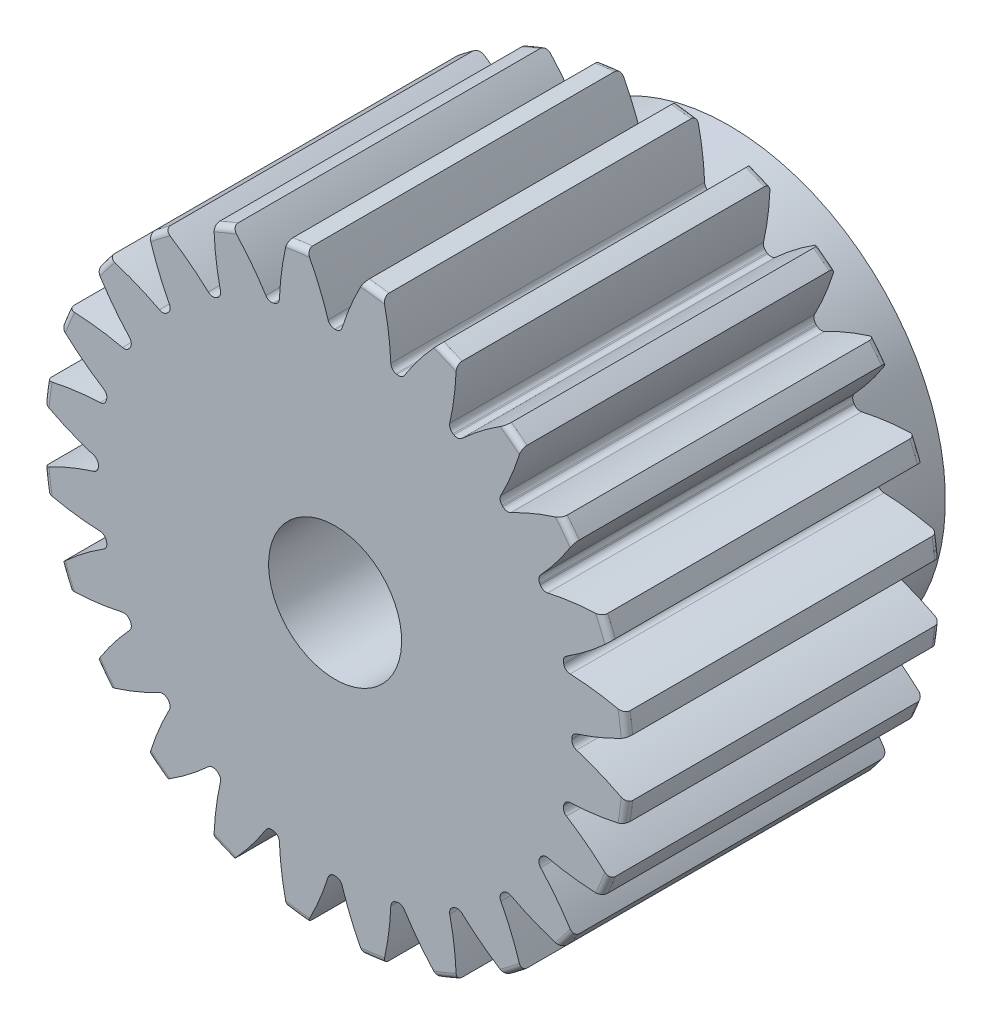
from build123d import *

# Parameters (mm, degrees)
FILLET2_R           = 0.2751582
CUT_EXTRUDE2_DEPTH  = 25.404753734
CIRPATTERN1_COUNT   = 24
SKETCH8_R           = 10.16
BOSS_EXTRUDE1_DEPTH = 2.54
SKETCH14_R          = 10.16
BOSS_EXTRUDE2_DEPTH = 1.2192
SKETCH15_R          = 3.1242
CUT_EXTRUDE3_DEPTH  = 36.068


with BuildPart() as part:
    # Sketch4 → Revolve1 (revolve)
    with BuildSketch(Plane(origin=(0, 0, 0), x_dir=(0, 0, -1), z_dir=(1, 0, 0)), mode=Mode.PRIVATE) as revolve1_sk:
        Polygon((-14.732, 3.175), (-14.732, 0), (0, 0), (0, 3.175), (0, 13.75791), (-14.732, 13.75791), align=None)
    revolve(revolve1_sk.sketch.rotate(Axis((0, 0, 14.732), (0, 0, -1)), 180), axis=Axis((0, 0, 14.732), (0, 0, -1)))

    # Fillet2
    fillet2_edges = [part.edges().sort_by_distance(p)[0] for p in [
        (0, 13.75791, 0),
        (0, 13.75791, 14.732),
    ]]
    fillet(fillet2_edges, radius=FILLET2_R)

    # Sketch7 → Cut-Extrude2 (cut, through all)
    with BuildSketch(Plane.XY.offset(14.732)):
        with BuildLine():
            ThreePointArc((-0.025888514, 11.11204651), (0, 11.112076667), (0.025888514, 11.11204651))
            ThreePointArc((0.025888514, 11.11204651), (0.214525602, 11.173608764), (0.329782653, 11.335131749))
            ThreePointArc((0.329782653, 11.335131749), (0.772860919, 12.539479189), (1.335214608, 13.692964965))
            ThreePointArc((1.335214608, 13.692964965), (0, 13.75791), (-1.335214608, 13.692964965))
            ThreePointArc((-1.335214608, 13.692964965), (-0.772860919, 12.539479189), (-0.329782653, 11.335131749))
            ThreePointArc((-0.329782653, 11.335131749), (-0.214525602, 11.173608764), (-0.025888514, 11.11204651))
        make_face()
    cut_extrude2 = extrude(amount=-CUT_EXTRUDE2_DEPTH, mode=Mode.SUBTRACT)

    # CirPattern1: Cut-Extrude2 ×24 about axis
    cirpattern1_axis = Axis((0, 0, 0), (0, 0, 1))
    for i in range(1, CIRPATTERN1_COUNT):
        add(cut_extrude2.rotate(cirpattern1_axis, i * 360 / CIRPATTERN1_COUNT), mode=Mode.SUBTRACT)

    # Sketch8 → Boss-Extrude1 (add)
    with BuildSketch(Plane(origin=(0, 0, 0), x_dir=(-1, 0, 0), z_dir=(0, 0, -1))):
        with Locations(Location((0, 0, 0), (0, 0, 270))):
            Circle(SKETCH8_R)
    extrude(amount=BOSS_EXTRUDE1_DEPTH)

    # Sketch14 → Boss-Extrude2 (add)
    with BuildSketch(Plane(origin=(0, 0, -2.54), x_dir=(-1, 0, 0), z_dir=(0, 0, -1))):
        with Locations(Location((0, 0, 0), (0, 0, 270))):
            Circle(SKETCH14_R)
    extrude(amount=BOSS_EXTRUDE2_DEPTH)

    # Sketch15 → Cut-Extrude3 (cut)
    with BuildSketch(Plane(origin=(0, 0, -3.7592), x_dir=(-1, 0, 0), z_dir=(0, 0, -1))):
        with Locations(Location((0, 0, 0), (0, 0, 90))):
            Circle(SKETCH15_R)
    extrude(amount=-CUT_EXTRUDE3_DEPTH, mode=Mode.SUBTRACT)


solid = part.part
